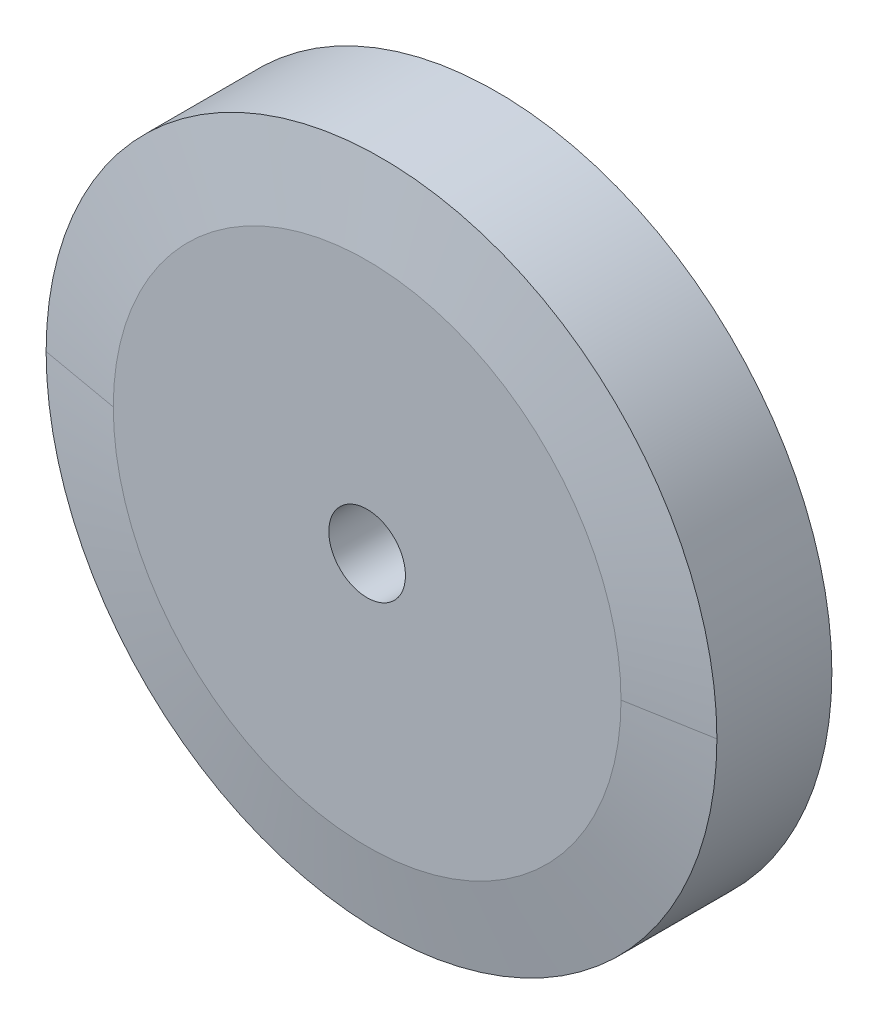
from build123d import *

# Parameters (mm, degrees)
SKETCH_2_R          = 35
EXTRUDE_1_DEPTH     = 15
SKETCH_5_R          = 4
CUT_EXTRUDE_1_DEPTH = 20


with BuildPart() as part:
    # 스케치2 → 보스-돌출1 (new body)
    with BuildSketch(Plane.XY):
        Circle(SKETCH_2_R)
    extrude(amount=EXTRUDE_1_DEPTH)

    # 스케치5 → 컷-돌출1 (cut)
    with BuildSketch(Plane.XY.offset(15)):
        Circle(SKETCH_5_R)
    extrude(amount=-CUT_EXTRUDE_1_DEPTH, mode=Mode.SUBTRACT)

    # 컷-스윕2: sweep along a curve in space
    with BuildLine() as sweep_2_path:
        ThreePointArc((35, 0, 0), (24.748737342, 24.748737342, 0), (0, 35, 0))
        ThreePointArc((0, 35, 0), (-24.748737342, 24.748737342, 0), (-35, 0, 0))
        ThreePointArc((-35, 0, 0), (-24.748737342, -24.748737342, 0), (0, -35, 0))
        ThreePointArc((0, -35, 0), (24.748737342, -24.748737342, 0), (35, 0, 0))
    # 스케치4 → 컷-스윕2 (sweep, cut)
    with BuildSketch(Plane(origin=(0, 0, 0), x_dir=(1, 0, 0), z_dir=(0, 1, 0))):
        Polygon((-35, -1.5), (-26.493077271, 0), (-35, 0), align=None)
        Polygon((-35, -15), (-26.493077271, -15), (-35, -13.5), align=None)
    sweep(path=sweep_2_path.line, mode=Mode.SUBTRACT)


solid = part.part
